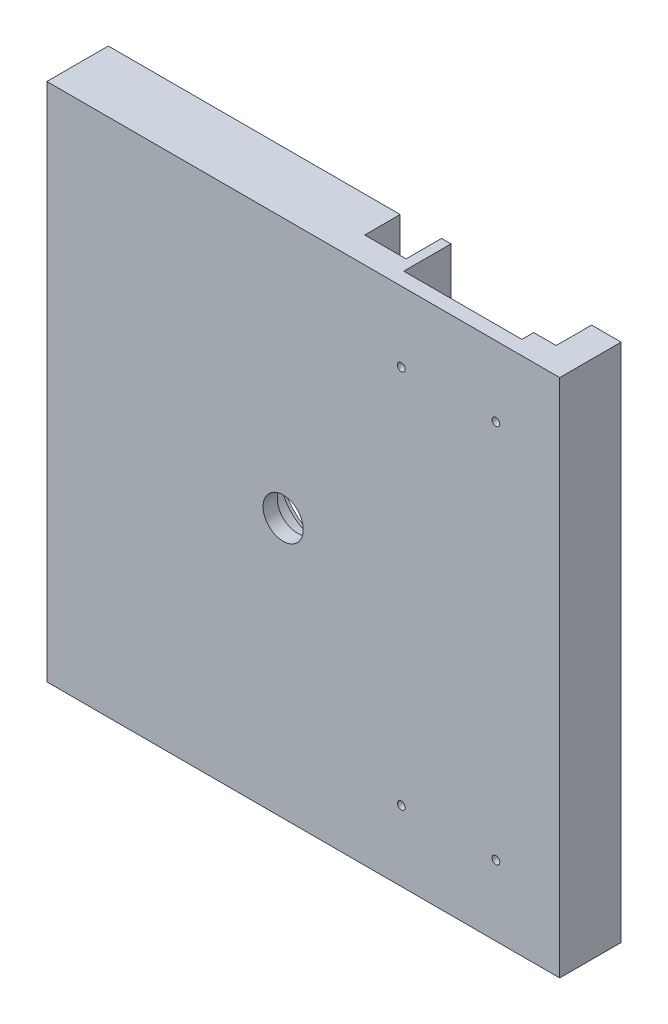
from build123d import *

# Parameters (mm, degrees)
ESBO_O1_W                           = 217
ESBO_O1_H                           = 220
RESSALTO_EXTRUS_O1_DEPTH            = 26
ESBO_O2_R                           = 30
CORTE_EXTRUS_O3_DEPTH               = 10
ESBO_O4_W                           = 17.5
ESBO_O4_H                           = 220
CORTE_EXTRUS_O4_DEPTH               = 15
CORTE_EXTRUS_O5_DEPTH               = 15
ESBO_O8_R                           = 17.5
CORTE_EXTRUS_O8_DEPTH               = 10
ESBO_O9_R                           = 8.5
CORTE_EXTRUS_O9_DEPTH               = 162.830157882
ESBO_O10_W                          = 50
ESBO_O10_H                          = 76.914505817
ESBO_O10_H_2                        = 74.113478202
CORTE_EXTRUS_O10_DEPTH              = 5
FILETE1_R                           = 3
FURO_ROSCADO_DE_M6X1_01_D           = 5
FURO_ROSCADO_DE_M6X1_01_DEPTH       = 17
FURO_ROSCADO_DE_M6X1_01_CSINK_D     = 6.05
FURO_ROSCADO_DE_M6X1_01_CSINK_ANGLE = 90
FURO_ROSCADO_DE_M6X1_01_TIP         = 1.502151548
FURO_ROSCADO_DE_M4X0_71_D           = 3.3
FURO_ROSCADO_DE_M4X0_71_DEPTH       = 11.5
FURO_ROSCADO_DE_M4X0_71_CSINK_D     = 4.05
FURO_ROSCADO_DE_M4X0_71_CSINK_ANGLE = 90
FURO_ROSCADO_DE_M4X0_71_TIP         = 0.991420021


with BuildPart() as part:
    # Esboço1 → Ressalto-extrusão1 (new body)
    with BuildSketch(Plane(origin=(15, 0, 10.5), x_dir=(1, 0, 0), z_dir=(0, 0, 1))):
        with Locations((-6.5, 0)):
            Rectangle(ESBO_O1_W, ESBO_O1_H)
    extrude(amount=RESSALTO_EXTRUS_O1_DEPTH)

    # Esboço2 → Corte-extrusão3 (cut)
    with BuildSketch(Plane(origin=(0, 0, 10.5), x_dir=(-1, 0, 0), z_dir=(0, 0, -1))):
        Circle(ESBO_O2_R)
    extrude(amount=-CORTE_EXTRUS_O3_DEPTH, mode=Mode.SUBTRACT)

    # Esboço4 → Corte-extrusão4 (cut)
    with BuildSketch(Plane(origin=(0, 0, 10.5), x_dir=(-1, 0, 0), z_dir=(0, 0, -1))):
        with Locations((-32.25, 0)):
            Rectangle(ESBO_O4_W, ESBO_O4_H)
    extrude(amount=-CORTE_EXTRUS_O4_DEPTH, mode=Mode.SUBTRACT)

    # Esboço5 → Corte-extrusão5 (cut)
    with BuildSketch(Plane(origin=(0, 0, 10.5), x_dir=(-1, 0, 0), z_dir=(0, 0, -1))):
        Polygon((-41, -52.3), (-41, 52.3), (-45, 52.3), (-45, 121.671237418), (-104.5, 121.671237418), (-104.5, -138.062287396), (-45, -138.062287396), (-45, -52.3), align=None)
    extrude(amount=-CORTE_EXTRUS_O5_DEPTH, mode=Mode.SUBTRACT)

    # Esboço8 → Corte-extrusão8 (cut)
    with BuildSketch(Plane(origin=(0, 0, 20.5), x_dir=(-1, 0, 0), z_dir=(0, 0, -1))):
        Circle(ESBO_O8_R)
    extrude(amount=-CORTE_EXTRUS_O8_DEPTH, mode=Mode.SUBTRACT)

    # Esboço9 → Corte-extrusão9 (cut, through all)
    with BuildSketch(Plane(origin=(0, 0, 30.5), x_dir=(-1, 0, 0), z_dir=(0, 0, -1))):
        Circle(ESBO_O9_R)
    extrude(amount=-CORTE_EXTRUS_O9_DEPTH, mode=Mode.SUBTRACT)

    # Esboço10 → Corte-extrusão10 (cut)
    with BuildSketch(Plane(origin=(0, 0, 25.5), x_dir=(-1, 0, 0), z_dir=(0, 0, -1))):
        with Locations((-70, -90.757252909)):
            Rectangle(ESBO_O10_W, ESBO_O10_H)
        with Locations((-70, 89.356739101)):
            Rectangle(ESBO_O10_W, ESBO_O10_H_2)
    extrude(amount=-CORTE_EXTRUS_O10_DEPTH, mode=Mode.SUBTRACT)

    # Filete1
    filete1_edges = [part.edges().sort_by_distance(p)[0] for p in [
        (45, 52.3, 28),
        (45, -52.3, 28),
        (95, -52.3, 28),
        (95, 52.3, 28),
    ]]
    fillet(filete1_edges, radius=FILETE1_R)

    # Furo roscado de M6x1.01
    with Locations(Plane(origin=(0, 0, 10.5), x_dir=(-1, 0, 0), z_dir=(0, 0, -1))):
        with Locations((-110.5, -100), (-110.5, 0), (-110.5, 100), (93.5, 100), (93.5, 0), (93.5, -100)):
            CounterSinkHole(FURO_ROSCADO_DE_M6X1_01_D / 2, FURO_ROSCADO_DE_M6X1_01_CSINK_D / 2, depth=FURO_ROSCADO_DE_M6X1_01_DEPTH, counter_sink_angle=FURO_ROSCADO_DE_M6X1_01_CSINK_ANGLE)
            with Locations((0, 0, -(FURO_ROSCADO_DE_M6X1_01_DEPTH + FURO_ROSCADO_DE_M6X1_01_TIP / 2))):  # 118° drill point
                Cone(0, FURO_ROSCADO_DE_M6X1_01_D / 2, FURO_ROSCADO_DE_M6X1_01_TIP, mode=Mode.SUBTRACT)

    # Furo roscado de M4x0.71
    with Locations(Plane(origin=(0, 0, 30.5), x_dir=(-1, 0, 0), z_dir=(0, 0, -1))):
        with Locations((-90, -80.3), (-50, -80.3), (-90, 80.3), (-50, 80.3)):
            CounterSinkHole(FURO_ROSCADO_DE_M4X0_71_D / 2, FURO_ROSCADO_DE_M4X0_71_CSINK_D / 2, depth=FURO_ROSCADO_DE_M4X0_71_DEPTH, counter_sink_angle=FURO_ROSCADO_DE_M4X0_71_CSINK_ANGLE)
            with Locations((0, 0, -(FURO_ROSCADO_DE_M4X0_71_DEPTH + FURO_ROSCADO_DE_M4X0_71_TIP / 2))):  # 118° drill point
                Cone(0, FURO_ROSCADO_DE_M4X0_71_D / 2, FURO_ROSCADO_DE_M4X0_71_TIP, mode=Mode.SUBTRACT)


solid = part.part
